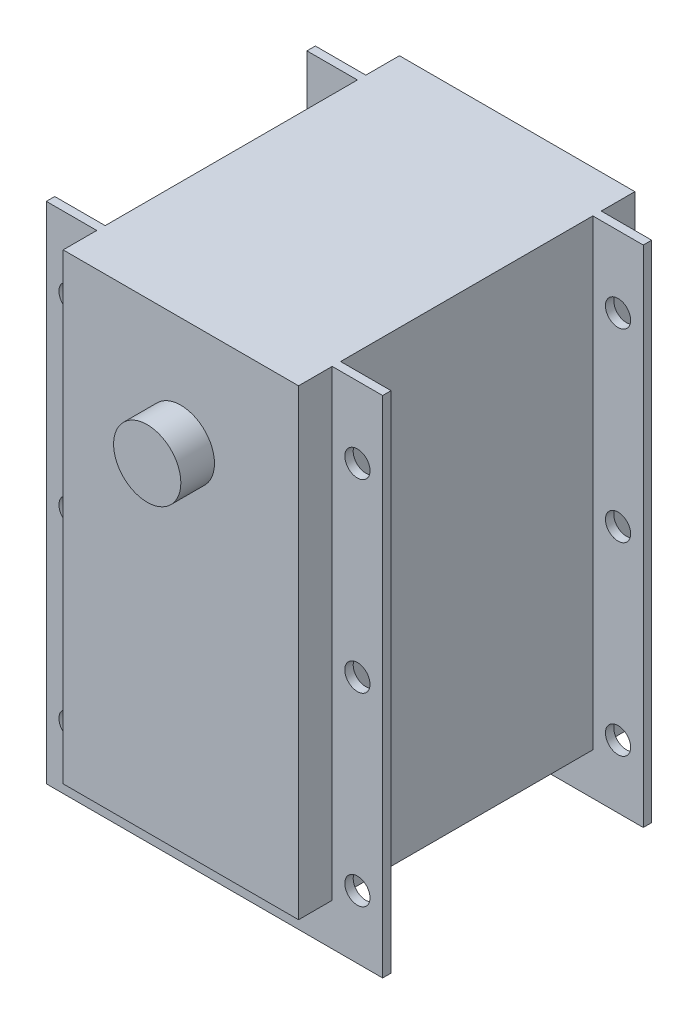
from build123d import *

# Parameters (mm, degrees)
SKETCH1_W           = 28
SKETCH1_H           = 55
BOSS_EXTRUDE1_DEPTH = 40
SKETCH3_W           = 40
SKETCH3_H           = 60
BOSS_EXTRUDE2_DEPTH = 1
SKETCH4_W           = 40
SKETCH4_H           = 60
BOSS_EXTRUDE3_DEPTH = 1
SKETCH5_R           = 1.5
CUT_EXTRUDE1_DEPTH  = 53.46189093
SKETCH6_R           = 4
BOSS_EXTRUDE4_DEPTH = 4
SKETCH7_R           = 3.5
BOSS_EXTRUDE5_DEPTH = 1


with BuildPart() as part:
    # Sketch1 → Boss-Extrude1 (new body)
    with BuildSketch(Plane.XY):
        with Locations((-6e-08, 0)):
            Rectangle(SKETCH1_W, SKETCH1_H)
    extrude(amount=BOSS_EXTRUDE1_DEPTH)

    # Sketch3 → Boss-Extrude2 (add)
    with BuildSketch(Plane.XY.offset(36)):
        with Locations((0, -2.5)):
            Rectangle(SKETCH3_W, SKETCH3_H)
    extrude(amount=-BOSS_EXTRUDE2_DEPTH)

    # Sketch4 → Boss-Extrude3 (add)
    with BuildSketch(Plane(origin=(0, 0, 4), x_dir=(-1, 0, 0), z_dir=(0, 0, -1))):
        with Locations((0, -2.5)):
            Rectangle(SKETCH4_W, SKETCH4_H)
    extrude(amount=-BOSS_EXTRUDE3_DEPTH)

    # Sketch5 → Cut-Extrude1 (cut, through all)
    with BuildSketch(Plane.XY.offset(36)):
        with Locations(Location((-17, 19, 0), (0, 0, 180))):
            Circle(SKETCH5_R)
        with Locations(Location((17, 18.999999934, 0), (0, 0, 180))):
            Circle(SKETCH5_R)
        with Locations(Location((-17, -3, 0), (0, 0, 180))):
            Circle(SKETCH5_R)
        with Locations(Location((17, -3.000000066, 0), (0, 0, 180))):
            Circle(SKETCH5_R)
        with Locations(Location((17, -25.000000066, 0), (0, 0, 180))):
            Circle(SKETCH5_R)
        with Locations(Location((-17, -25, 0), (0, 0, 180))):
            Circle(SKETCH5_R)
    extrude(amount=-CUT_EXTRUDE1_DEPTH, mode=Mode.SUBTRACT)

    # Sketch6 → Boss-Extrude4 (add)
    with BuildSketch(Plane.XY.offset(40)):
        with Locations((0, 14.5)):
            Circle(SKETCH6_R)
    extrude(amount=BOSS_EXTRUDE4_DEPTH)

    # Sketch7 → Boss-Extrude5 (add)
    with BuildSketch(Plane(origin=(0, 0, 0), x_dir=(-1, 0, 0), z_dir=(0, 0, -1))):
        with Locations(Location((0, 13.5, 0), (0, 0, 180))):
            Circle(SKETCH7_R)
    extrude(amount=BOSS_EXTRUDE5_DEPTH)


solid = part.part
